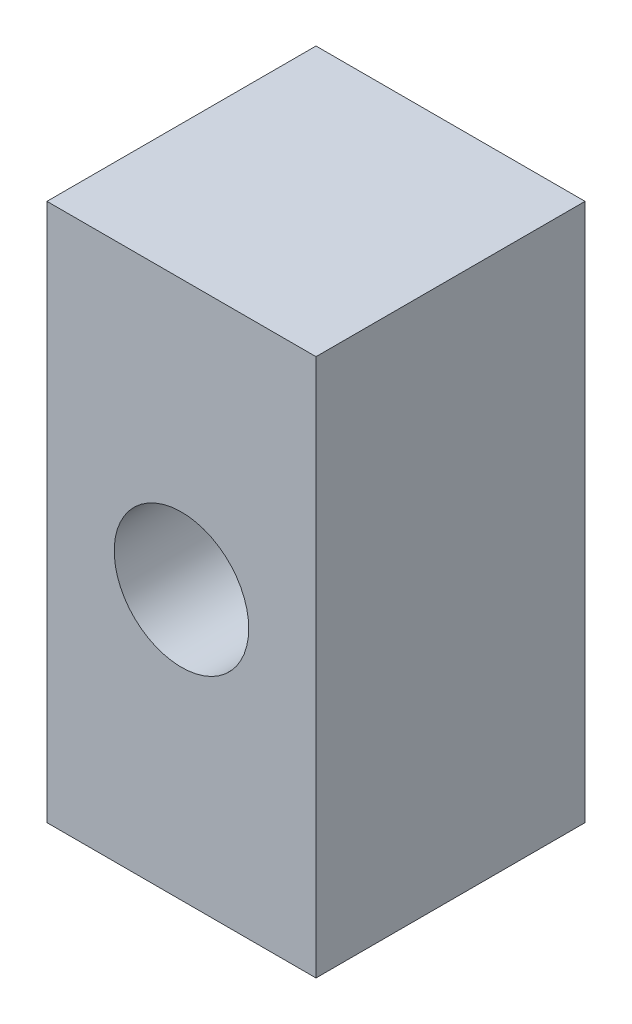
from build123d import *

# Parameters (mm, degrees)
SKETCH2_W           = 50.8
SKETCH2_H           = 101.6
SKETCH2_R           = 12.7
BOSS_EXTRUDE1_DEPTH = 50.8


with BuildPart() as part:
    # Sketch2 → Boss-Extrude1 (new body)
    with BuildSketch(Plane.XY):
        with Locations((-18.373080551, -10.75414)):
            Rectangle(SKETCH2_W, SKETCH2_H)
        with Locations((-18.373080551, -10.75414)):
            Circle(SKETCH2_R, mode=Mode.SUBTRACT)
    extrude(amount=BOSS_EXTRUDE1_DEPTH)


solid = part.part
